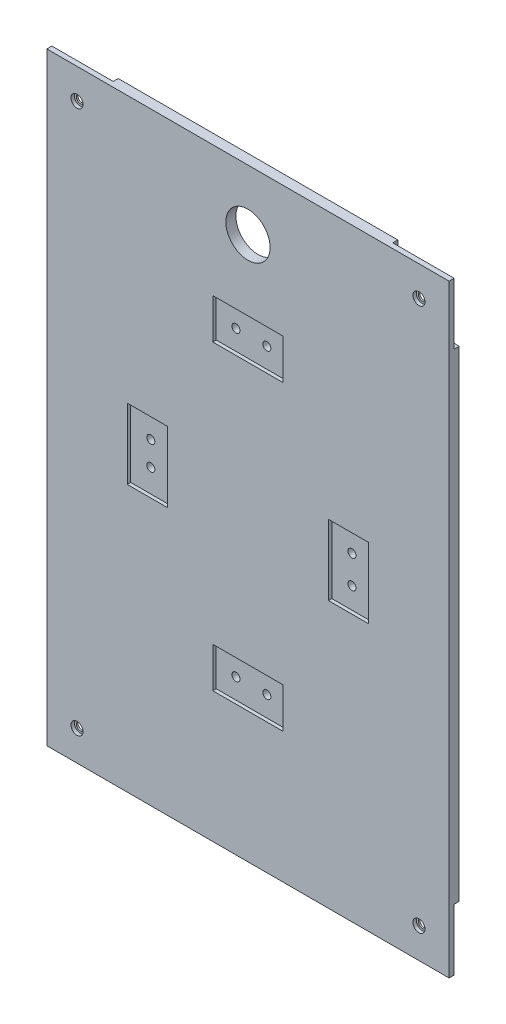
from build123d import *

# Parameters (mm, degrees)
CROQUIS1_W              = 200
CROQUIS1_H              = 300
SALIENTE_EXTRUIR1_DEPTH = 5
CROQUIS2_R              = 11
CORTAR_EXTRUIR1_DEPTH   = 15
CROQUIS3_R              = 2
AG_COLUMNA_DEPTH        = 15
CROQUIS4_R              = 2
CORTAR_EXTRUIR3_DEPTH   = 15
CROQUIS5_R              = 3
CROQUIS5_W              = 20
CROQUIS5_H              = 35
CROQUIS5_W_2            = 35
CROQUIS5_H_2            = 20
CORTAR_EXTRUIR4_DEPTH   = 1.7
CROQUIS6_W              = 30.5
CROQUIS6_H              = 30.5
CORTAR_EXTRUIR5_DEPTH   = 2.5


with BuildPart() as part:
    # Croquis1 → Saliente-Extruir1 (new body)
    with BuildSketch(Plane.XY):
        Rectangle(CROQUIS1_W, CROQUIS1_H)
    extrude(amount=SALIENTE_EXTRUIR1_DEPTH)

    # Croquis2 → Cortar-Extruir1 (cut)
    with BuildSketch(Plane.XY.offset(5)):
        with Locations((0, 120)):
            Circle(CROQUIS2_R)
    extrude(amount=-CORTAR_EXTRUIR1_DEPTH, mode=Mode.SUBTRACT)

    # Croquis3 → Ag. Columna (cut)
    with BuildSketch(Plane.XY.offset(5)):
        with Locations((85, 135)):
            Circle(CROQUIS3_R)
        with Locations((-85, 135)):
            Circle(CROQUIS3_R)
        with Locations((-85, -135)):
            Circle(CROQUIS3_R)
        with Locations((85, -135)):
            Circle(CROQUIS3_R)
    extrude(amount=-AG_COLUMNA_DEPTH, mode=Mode.SUBTRACT)

    # Croquis4 → Cortar-Extruir3 (cut)
    with BuildSketch(Plane.XY.offset(5)):
        with Locations((-50, 6)):
            Circle(CROQUIS4_R)
        with Locations(Location((-50, -6, 0), (0, 0, 180))):
            Circle(CROQUIS4_R)
        with Locations((50, -7)):
            Circle(CROQUIS4_R)
        with Locations(Location((50, 7, 0), (0, 0, 180))):
            Circle(CROQUIS4_R)
        with Locations((-7.668433443, 75)):
            Circle(CROQUIS4_R)
        with Locations(Location((7.668433443, 75, 0), (0, 0, 180))):
            Circle(CROQUIS4_R)
        with Locations(Location((-7.668433443, -75, 0), (0, 0, 180))):
            Circle(CROQUIS4_R)
        with Locations((7.668433443, -75)):
            Circle(CROQUIS4_R)
    extrude(amount=-CORTAR_EXTRUIR3_DEPTH, mode=Mode.SUBTRACT)

    # Croquis5 → Cortar-Extruir4 (cut)
    with BuildSketch(Plane.XY.offset(5)):
        with Locations((-85, 135)):
            Circle(CROQUIS5_R)
        with Locations(Location((85, 135, 0), (0, 0, 180))):
            Circle(CROQUIS5_R)
        with Locations(Location((-85, -135, 0), (0, 0, 180))):
            Circle(CROQUIS5_R)
        with Locations((85, -135)):
            Circle(CROQUIS5_R)
        with Locations((-50, 0)):
            Rectangle(CROQUIS5_W, CROQUIS5_H)
        with Locations((0, -75.070372891)):
            Rectangle(CROQUIS5_W_2, CROQUIS5_H_2)
        with Locations((0, 75.070372891)):
            Rectangle(CROQUIS5_W_2, CROQUIS5_H_2)
        with Locations((50, 0)):
            Rectangle(CROQUIS5_W, CROQUIS5_H)
    extrude(amount=-CORTAR_EXTRUIR4_DEPTH, mode=Mode.SUBTRACT)

    # Croquis6 → Cortar-Extruir5 (cut)
    with BuildSketch(Plane(origin=(0, 0, 0), x_dir=(-1, 0, 0), z_dir=(0, 0, -1))):
        with Locations((-84.75, 134.75)):
            Rectangle(CROQUIS6_W, CROQUIS6_H)
        with Locations((84.75, 134.75)):
            Rectangle(CROQUIS6_W, CROQUIS6_H)
        with Locations((84.75, -134.75)):
            Rectangle(CROQUIS6_W, CROQUIS6_H)
        with Locations((-84.75, -134.75)):
            Rectangle(CROQUIS6_W, CROQUIS6_H)
    extrude(amount=-CORTAR_EXTRUIR5_DEPTH, mode=Mode.SUBTRACT)


solid = part.part
